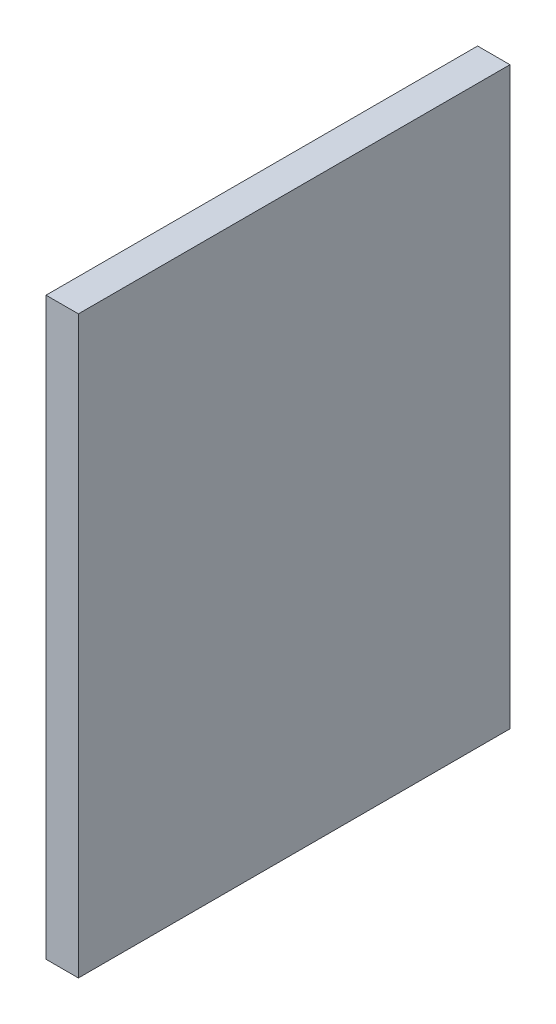
from build123d import *

# Parameters (mm, degrees)
SKETCH1_W           = 40
SKETCH1_H           = 53.310651977
BOSS_EXTRUDE1_DEPTH = 3


with BuildPart() as part:
    # Sketch1 → Boss-Extrude1 (new body)
    with BuildSketch(Plane(origin=(0, 0, 0), x_dir=(0, 0, -1), z_dir=(1, 0, 0))):
        with Locations((0, -8.381944693)):
            Rectangle(SKETCH1_W, SKETCH1_H)
    extrude(amount=BOSS_EXTRUDE1_DEPTH)


solid = part.part
